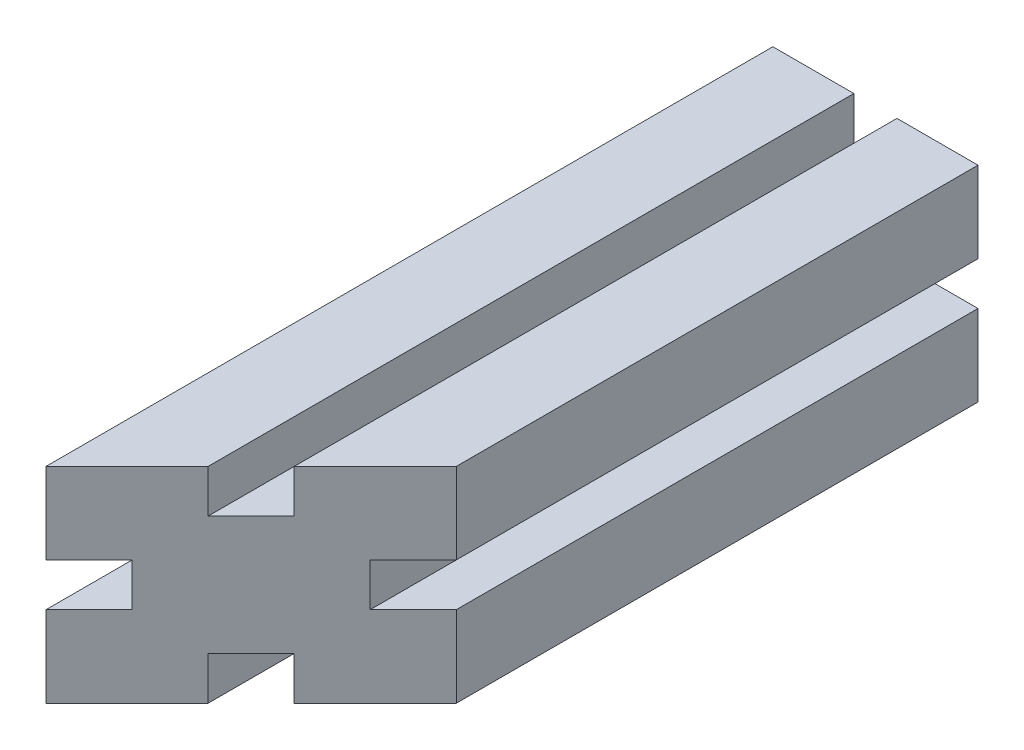
from build123d import *

# Parameters (mm, degrees)
PROFILE_DEPTH     = 135
MITER1_DEPTH      = 138.66192284
MITER1_DEPTH_BACK = 138.66192284


with BuildPart() as part:
    # Sketch1 → Profile (new body)
    with BuildSketch(Plane.XY):
        Polygon((-19.05, -19.05), (-4, -19.05), (-4, -11.05), (4, -11.05), (4, -19.05), (19.05, -19.05), (19.05, -4), (11.05, -4), (11.05, 4), (19.05, 4), (19.05, 19.05), (4, 19.05), (4, 11.05), (-4, 11.05), (-4, 19.05), (-19.05, 19.05), (-19.05, 4), (-11.05, 4), (-11.05, -4), (-19.05, -4), align=None)
    extrude(amount=PROFILE_DEPTH)

    # Sketch2 → Miter1 (cut, two sides: drawn at the far end of the back side and taken through both)
    with BuildSketch(Plane(origin=(0, 0, 0), x_dir=(1, 0, 0), z_dir=(0, 1, 0)).offset(-MITER1_DEPTH_BACK)):
        Polygon((-19.05, -135), (25, -90.95), (25, -145), align=None)
    extrude(amount=MITER1_DEPTH + MITER1_DEPTH_BACK, mode=Mode.SUBTRACT)


solid = part.part
